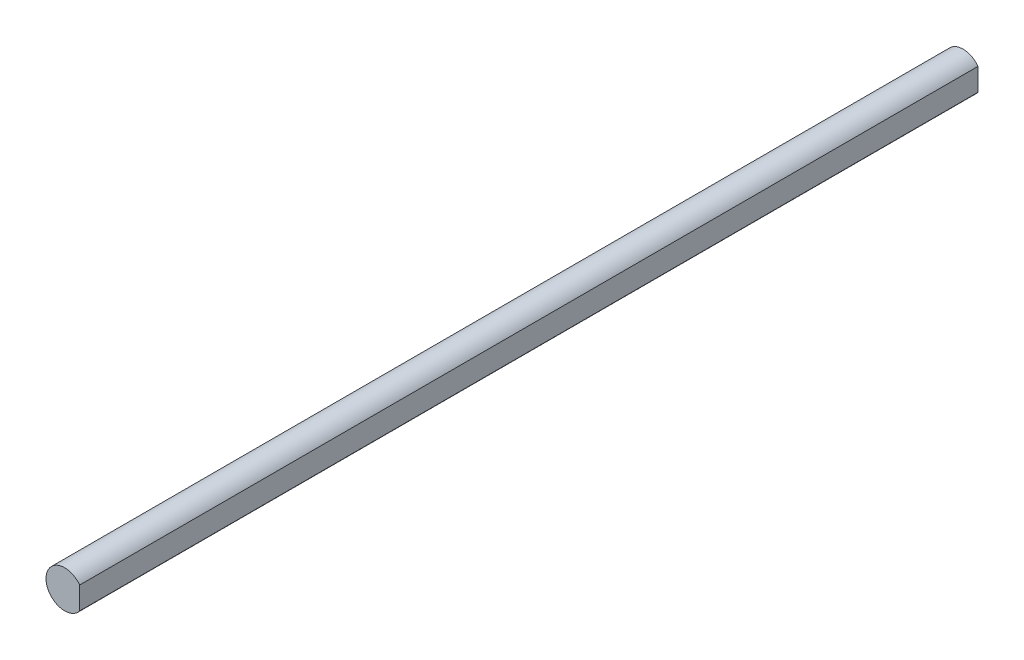
from build123d import *

# Parameters (mm, degrees)
ESQUISSE1_R             = 3.175
BOSS_EXTRU_1_DEPTH      = 152.4
ENL_V_MAT_EXTRU_1_REACH = 154.466
ESQUISSE2_W             = 2.253907943
ESQUISSE2_H             = 5.669710073


with BuildPart() as part:
    # Esquisse1 → Boss.-Extru.1 (new body)
    with BuildSketch(Plane.XY):
        with Locations(Location((0, 0, 0), (0, 0, 180))):
            Circle(ESQUISSE1_R)
    extrude(amount=BOSS_EXTRU_1_DEPTH)

    # Esquisse2 → Enlèv. mat.-Extru.1 (cut, up to next)
    with BuildSketch(Plane(origin=(0, 0, 0), x_dir=(-1, 0, 0), z_dir=(0, 0, -1)), mode=Mode.PRIVATE) as enl_v_mat_extru_1_sk1:
        with Locations((-3.666953972, -0.340144964)):
            Rectangle(ESQUISSE2_W, ESQUISSE2_H)
    enl_v_mat_extru_1_tool1 = extrude(enl_v_mat_extru_1_sk1.sketch, amount=-ENL_V_MAT_EXTRU_1_REACH, mode=Mode.PRIVATE) & part.part
    add(enl_v_mat_extru_1_tool1.solids().sort_by_distance((3.666954, -0.340145, 0))[0], mode=Mode.SUBTRACT)


solid = part.part
